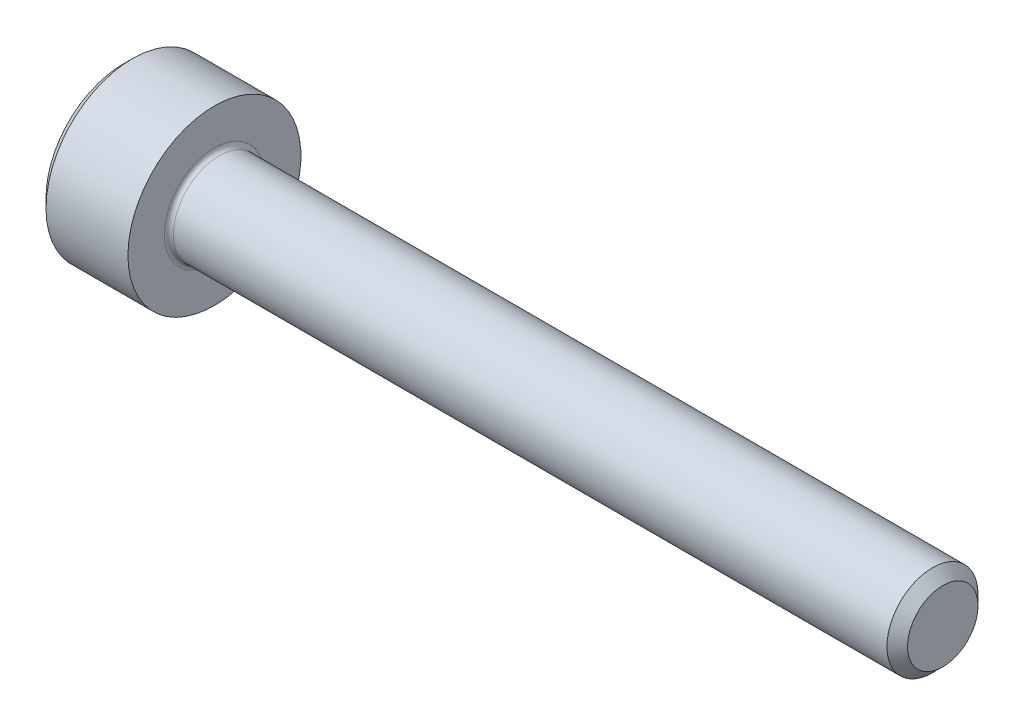
from build123d import *

# Parameters (mm, degrees)
FILLET1_R   = 0.1
HEX_2_DEPTH = 1


with BuildPart() as part:
    # BodySke → Base-Revolve (revolve)
    with BuildSketch(Plane.XY, mode=Mode.PRIVATE) as base_revolve_sk:
        Polygon((0, 0), (0, 1.7), (0.2, 1.9), (2, 1.9), (2, 1), (17.774, 1), (18, 0.774), (18, 0), align=None)
    revolve(base_revolve_sk.sketch.rotate(Axis((-31.75, 0, 0), (1, 0, 0)), 90), axis=Axis((-31.75, 0, 0), (1, 0, 0)))

    # Fillet1
    fillet1_edges = [part.edges().sort_by_distance(p)[0] for p in [
        (2, 0, -1),
    ]]
    fillet(fillet1_edges, radius=FILLET1_R)

    # Sketch2 → Hex-PreBroach (revolve, cut)
    with BuildSketch(Plane.XY, mode=Mode.PRIVATE) as hex_prebroach_sk:
        Polygon((0, 0.7725), (1, 0.7725), (1.446003083, 0), (0, 0), align=None)
    revolve(hex_prebroach_sk.sketch.rotate(Axis((0, 0, 0), (1, 0, 0)), 90), axis=Axis((0, 0, 0), (1, 0, 0)), mode=Mode.SUBTRACT)

    # Sketch3 → Hex 2 (cut)
    with BuildSketch(Plane(origin=(0, 0, 0), x_dir=(0, 0.500000000000001, 0.866025403784438), z_dir=(-1, 0, 0))):
        Polygon((0.446003083, 0.7725), (-0.446003083, 0.7725), (-0.892006166, 0), (-0.446003083, -0.7725), (0.446003083, -0.7725), (0.892006166, 0), align=None)
    extrude(amount=-HEX_2_DEPTH, mode=Mode.SUBTRACT)


solid = part.part
